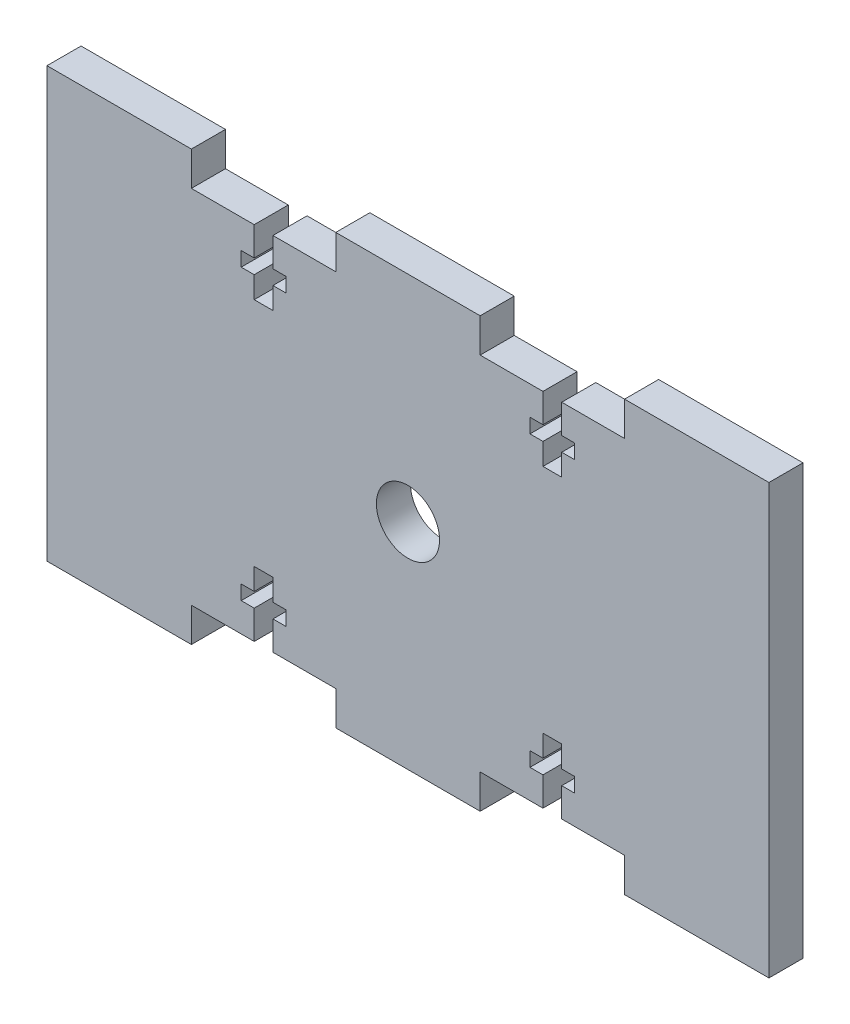
from build123d import *

# Parameters (mm, degrees)
BOSS_EXTRUDE1_DEPTH = 5.9944
CUT_EXTRUDE2_DEPTH  = 5.9944
SKETCH3_R           = 5.55625
CUT_EXTRUDE3_DEPTH  = 5.9944


with BuildPart() as part:
    # Sketch1 → Boss-Extrude1 (new body)
    with BuildSketch(Plane.XY):
        Polygon((25.4, 5.9944), (50.8, 5.9944), (50.8, 0), (76.2, 0), (76.2, 5.9944), (101.6, 5.9944), (101.6, 0), (127, 0), (127, 75.4888), (101.6, 75.4888), (101.6, 69.4944), (76.2, 69.4944), (76.2, 75.4888), (50.8, 75.4888), (50.8, 69.4944), (25.4, 69.4944), (25.4, 75.4888), (0, 75.4888), (0, 0), (25.4, 0), align=None)
    extrude(amount=BOSS_EXTRUDE1_DEPTH)

    # Sketch2 → Cut-Extrude2 (cut)
    with BuildSketch(Plane.XY.offset(5.9944)):
        Polygon((36.449, 69.4944), (36.449, 64.4144), (34.163, 64.4144), (34.163, 61.8744), (36.449, 61.8744), (36.449, 58.0644), (39.751, 58.0644), (39.751, 61.8744), (42.037, 61.8744), (42.037, 64.4144), (39.751, 64.4144), (39.751, 69.4944), align=None)
        Polygon((36.449, 5.9944), (39.751, 5.9944), (39.751, 11.0744), (42.037, 11.0744), (42.037, 13.6144), (39.751, 13.6144), (39.751, 17.4244), (36.449, 17.4244), (36.449, 13.6144), (34.163, 13.6144), (34.163, 11.0744), (36.449, 11.0744), align=None)
        Polygon((90.551, 5.9944), (90.551, 11.0744), (92.837, 11.0744), (92.837, 13.6144), (90.551, 13.6144), (90.551, 17.4244), (87.249, 17.4244), (87.249, 13.6144), (84.963, 13.6144), (84.963, 11.0744), (87.249, 11.0744), (87.249, 5.9944), align=None)
        Polygon((90.551, 69.4944), (87.249, 69.4944), (87.249, 64.4144), (84.963, 64.4144), (84.963, 61.8744), (87.249, 61.8744), (87.249, 58.0644), (90.551, 58.0644), (90.551, 61.8744), (92.837, 61.8744), (92.837, 64.4144), (90.551, 64.4144), align=None)
    extrude(amount=-CUT_EXTRUDE2_DEPTH, mode=Mode.SUBTRACT)

    # Sketch3 → Cut-Extrude3 (cut)
    with BuildSketch(Plane.XY.offset(5.9944)):
        with Locations((63.5, 37.7444)):
            Circle(SKETCH3_R)
    extrude(amount=-CUT_EXTRUDE3_DEPTH, mode=Mode.SUBTRACT)


solid = part.part
